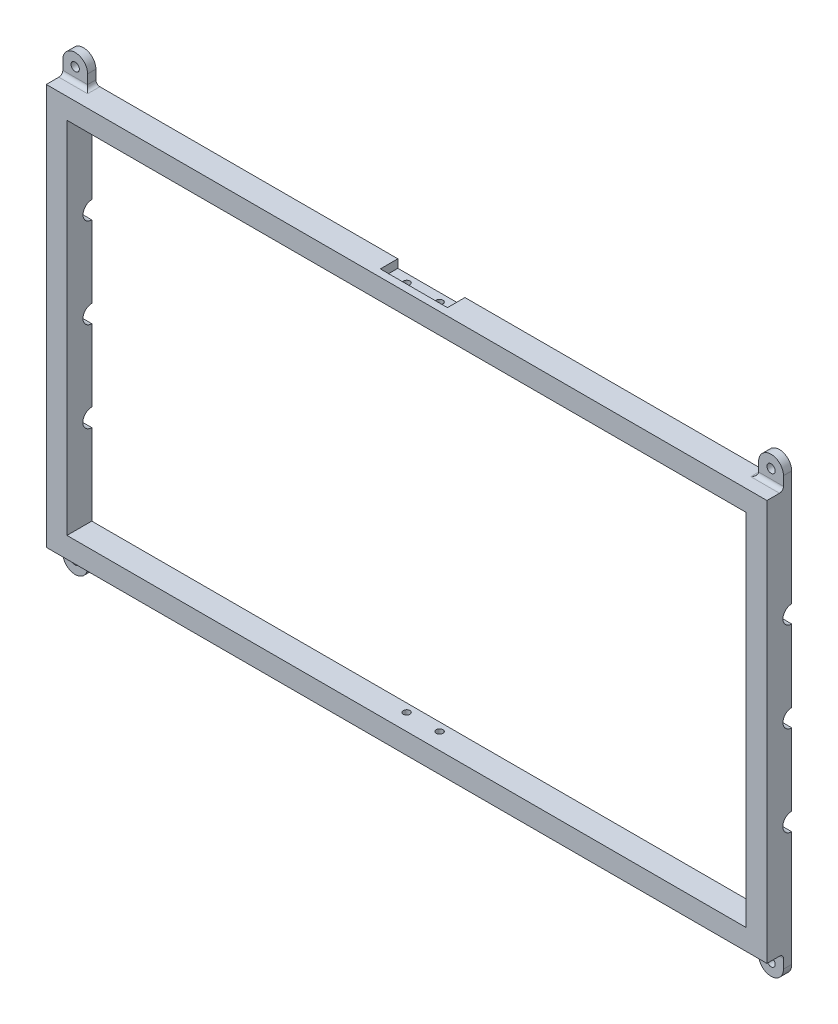
from build123d import *

# Parameters (mm, degrees)
SKETCH1_W               = 276.86
SKETCH1_H               = 154.0256
SKETCH1_W_2             = 260.9596
SKETCH1_H_2             = 138.1252
BOSS_EXTRUDE1_DEPTH     = 9.525
SKETCH2_R               = 3.3655
SKETCH2_R_2             = 3.429
CUT_EXTRUDE1_DEPTH      = 288.52940126
SKETCH3_R               = 1.5875
BOSS_EXTRUDE2_DEPTH     = 3.175
MIRROR2_COPY_1_SKETCH_R = 1.5875
MIRROR2_COPY_1_DEPTH    = 3.175
FILLET1_R               = 1.524
SKETCH4_W               = 25.781
SKETCH4_H               = 13.462
CUT_EXTRUDE2_DEPTH      = 3.175
CUT_EXTRUDE3_REACH      = 214.311
SKETCH5_R               = 1.27


with BuildPart() as part:
    # Sketch1 → Boss-Extrude1 (new body)
    with BuildSketch(Plane.XY):
        Rectangle(SKETCH1_W, SKETCH1_H)
        Rectangle(SKETCH1_W_2, SKETCH1_H_2, mode=Mode.SUBTRACT)
    extrude(amount=BOSS_EXTRUDE1_DEPTH)

    # Sketch2 → Cut-Extrude1 (cut, through all)
    with BuildSketch(Plane(origin=(138.43, 0, 0), x_dir=(0, 0, -1), z_dir=(1, 0, 0))):
        Circle(SKETCH2_R)
        with Locations((0, 34.5313)):
            Circle(SKETCH2_R)
        with Locations((0, -34.5313)):
            Circle(SKETCH2_R_2)
    extrude(amount=-CUT_EXTRUDE1_DEPTH, mode=Mode.SUBTRACT)

    # Sketch3 → Boss-Extrude2 (add)
    with BuildSketch(Plane(origin=(0, 0, 0), x_dir=(-1, 0, 0), z_dir=(0, 0, -1))):
        with BuildLine():
            Line((-138.43, 77.0128), (-138.43, 82.0928))
            ThreePointArc((-138.43, 82.0928), (-133.6675, 86.8553), (-128.905, 82.0928))
            Line((-128.905, 82.0928), (-128.905, 77.0128))
            Line((-128.905, 77.0128), (-138.43, 77.0128))
        make_face()
        with Locations((-133.6675, 82.0928)):
            Circle(SKETCH3_R, mode=Mode.SUBTRACT)
    boss_extrude2 = extrude(amount=-BOSS_EXTRUDE2_DEPTH)

    # Mirror1: Boss-Extrude2 across plane
    add(boss_extrude2.mirror(Plane(origin=(0, 0, 0), x_dir=(0, 0, 1), z_dir=(1, 0, 0))))

    # Mirror2: Boss-Extrude2 across plane
    add(boss_extrude2.mirror(Plane.ZX))

    # Mirror2 copy 1 sketch → Mirror2 copy 1 (add)
    with BuildSketch(Plane(origin=(0, 0, 0), x_dir=(1, 0, 0), z_dir=(0, 0, -1))):
        with BuildLine():
            Line((-138.43, 77.0128), (-138.43, 82.0928))
            ThreePointArc((-138.43, 82.0928), (-133.6675, 86.8553), (-128.905, 82.0928))
            Line((-128.905, 82.0928), (-128.905, 77.0128))
            Line((-128.905, 77.0128), (-138.43, 77.0128))
        make_face()
        with Locations((-133.6675, 82.0928)):
            Circle(MIRROR2_COPY_1_SKETCH_R, mode=Mode.SUBTRACT)
    extrude(amount=-MIRROR2_COPY_1_DEPTH)

    # Fillet1
    fillet1_edges = [part.edges().sort_by_distance(p)[0] for p in [
        (133.6675, -77.0128, 3.175),
        (128.905, -77.0128, 1.5875),
        (-133.6675, -77.0128, 3.175),
        (-128.905, -77.0128, 1.5875),
        (133.6675, 77.0128, 3.175),
        (128.905, 77.0128, 1.5875),
        (-133.6675, 77.0128, 3.175),
        (-128.905, 77.0128, 1.5875),
    ]]
    fillet(fillet1_edges, radius=FILLET1_R)

    # Sketch4 → Cut-Extrude2 (cut)
    with BuildSketch(Plane(origin=(0, 77.0128, 0), x_dir=(1, 0, 0), z_dir=(0, 1, 0))):
        Rectangle(SKETCH4_W, SKETCH4_H)
    cut_extrude2 = extrude(amount=-CUT_EXTRUDE2_DEPTH, mode=Mode.SUBTRACT)

    # Sketch5 → Cut-Extrude3 (cut, up to next)
    with BuildSketch(Plane(origin=(0, 73.8378, 0), x_dir=(1, 0, 0), z_dir=(0, 1, 0)), mode=Mode.PRIVATE) as cut_extrude3_sk1:
        with Locations(Location((6.35, -3.175, 0), (0, 0, 270))):
            Circle(SKETCH5_R)
    cut_extrude3_tool1 = extrude(cut_extrude3_sk1.sketch, amount=-CUT_EXTRUDE3_REACH, mode=Mode.PRIVATE) & part.part
    # Sketch5 → Cut-Extrude3 (cut, up to next)
    with BuildSketch(Plane(origin=(0, 73.8378, 0), x_dir=(1, 0, 0), z_dir=(0, 1, 0)), mode=Mode.PRIVATE) as cut_extrude3_sk2:
        with Locations(Location((-6.35, -3.175, 0), (0, 0, 270))):
            Circle(SKETCH5_R)
    cut_extrude3_tool2 = extrude(cut_extrude3_sk2.sketch, amount=-CUT_EXTRUDE3_REACH, mode=Mode.PRIVATE) & part.part
    cut_extrude3_1 = cut_extrude3_tool1.solids().sort_by_distance((6.35, 73.8378, 3.175))[0]
    add(cut_extrude3_1, mode=Mode.SUBTRACT)
    cut_extrude3_2 = cut_extrude3_tool2.solids().sort_by_distance((-6.35, 73.8378, 3.175))[0]
    add(cut_extrude3_2, mode=Mode.SUBTRACT)
    cut_extrude3 = cut_extrude3_1 + cut_extrude3_2  # Cut-Extrude3 as one shape, for the pattern or mirror that repeats it

    # Mirror3: Cut-Extrude2, Cut-Extrude3 across plane
    add(cut_extrude2.mirror(Plane.ZX), mode=Mode.SUBTRACT)
    add(cut_extrude3.mirror(Plane.ZX), mode=Mode.SUBTRACT)


solid = part.part
